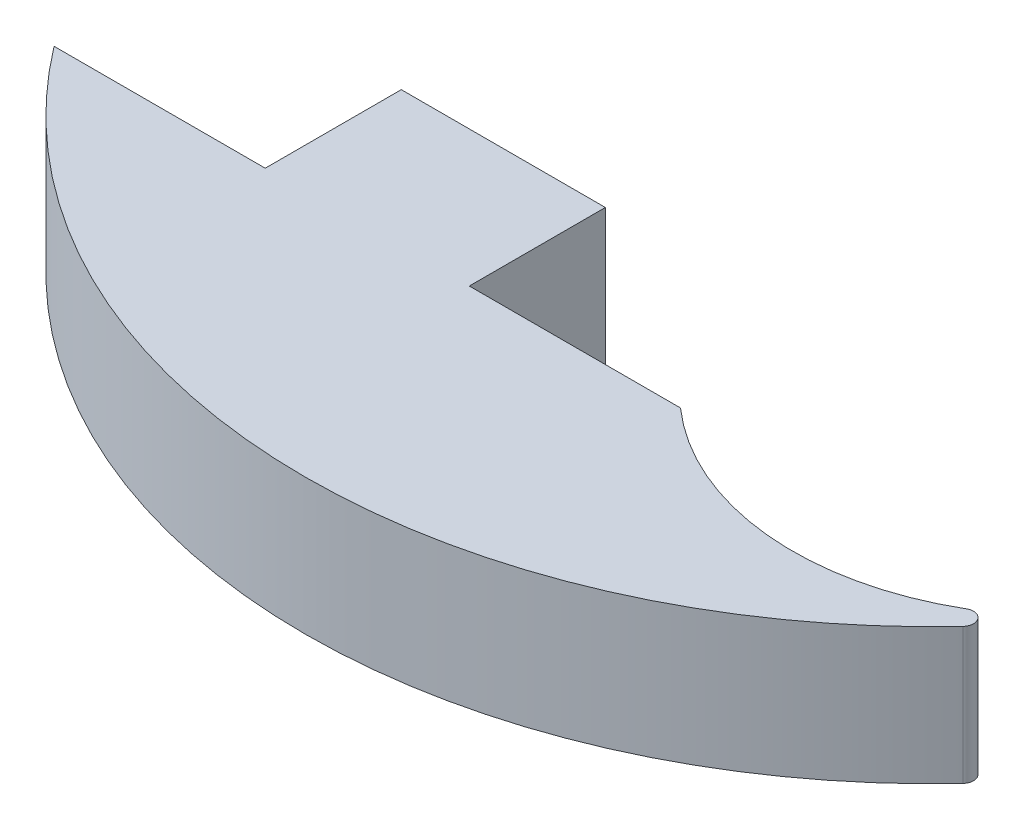
from build123d import *

# Parameters (mm, degrees)
BOSS_EXTRUDE1_DEPTH = 3.175
SKETCH2_W           = 9.525
SKETCH2_H           = 6.35
BOSS_EXTRUDE2_DEPTH = 6.35
CUT_EXTRUDE1_DEPTH  = 78.291604858


with BuildPart() as part:
    # Sketch1 → Boss-Extrude1 (new, symmetric)
    with BuildSketch(Plane(origin=(0, 0, 0), x_dir=(1, 0, 0), z_dir=(0, 1, 0))):
        with BuildLine():
            Line((-41.502443258, -43.180856192), (-54.202443258, -43.180856192))
            ThreePointArc((-54.202443258, -43.180856192), (-28.976499653, -54.667950949), (-5.512754363, -39.911452934))
            ThreePointArc((-5.512754363, -39.911452934), (-14.460289915, -46.180199356), (-24.965503608, -43.180856192))
            Line((-24.965503608, -43.180856192), (-41.502443258, -43.180856192))
        make_face()
    extrude(amount=BOSS_EXTRUDE1_DEPTH, both=True)

    # Sketch2 → Boss-Extrude2 (add)
    with BuildSketch(Plane(origin=(0, 3.175, 0), x_dir=(1, 0, 0), z_dir=(0, 1, 0))):
        with Locations((-39.583973433, -40.005856192)):
            Rectangle(SKETCH2_W, SKETCH2_H)
    extrude(amount=-BOSS_EXTRUDE2_DEPTH)

    # Sketch3 → Cut-Extrude1 (cut, through all)
    with BuildSketch(Plane(origin=(0, 3.175, 0), x_dir=(1, 0, 0), z_dir=(0, 1, 0))):
        with BuildLine():
            ThreePointArc((-5.512754363, -39.911452934), (-7.527252939, -42.578004595), (-10.167597026, -44.626732342))
            ThreePointArc((-10.167597026, -44.626732342), (-9.515060164, -44.74815939), (-9.539624144, -45.411443263))
            ThreePointArc((-9.539624144, -45.411443263), (-7.365201872, -42.779316528), (-5.512754363, -39.911452934))
        make_face()
    extrude(amount=-CUT_EXTRUDE1_DEPTH, mode=Mode.SUBTRACT)


solid = part.part
